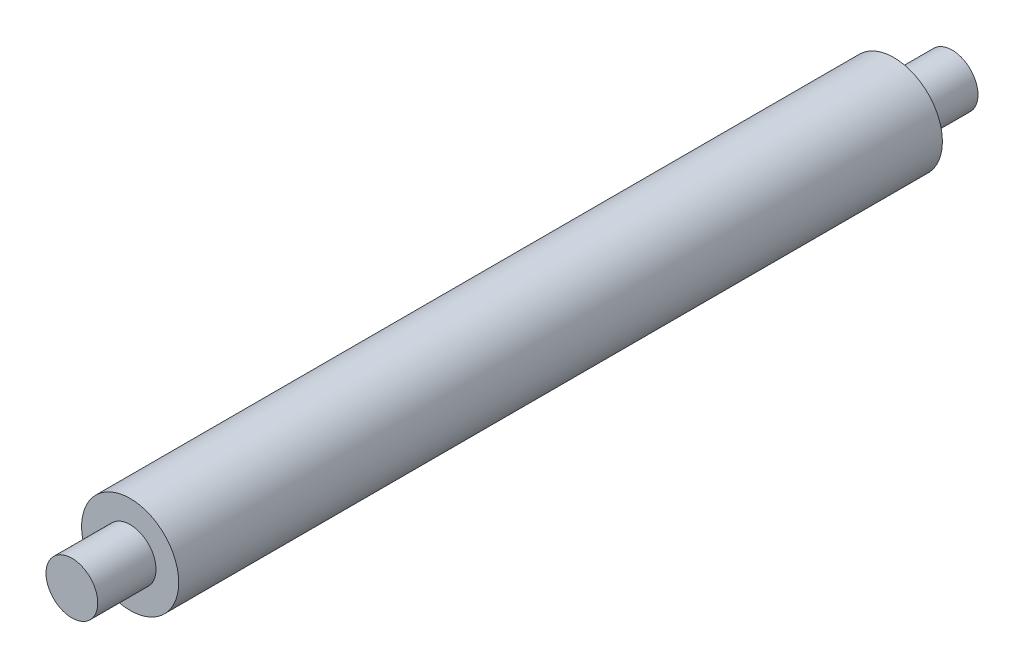
from build123d import *

# Parameters (mm, degrees)
SKETCH1_R           = 37.5
BOSS_EXTRUDE1_DEPTH = 295
SKETCH2_R           = 20
BOSS_EXTRUDE2_DEPTH = 45
BOSS_EXTRUDE3_START = 45
SKETCH3_R           = 20
BOSS_EXTRUDE3_DEPTH = 45


with BuildPart() as part:
    # Sketch1 → Boss-Extrude1 (new, symmetric)
    with BuildSketch(Plane.XY):
        Circle(SKETCH1_R)
    extrude(amount=BOSS_EXTRUDE1_DEPTH, both=True)

    # Sketch2 → Boss-Extrude2 (add)
    with BuildSketch(Plane.XY.offset(295)):
        with Locations(Location((0, 0, 0), (0, 0, 180))):
            Circle(SKETCH2_R)
    extrude(amount=BOSS_EXTRUDE2_DEPTH)

    # Sketch3 → Boss-Extrude3 (add)
    with BuildSketch(Plane(origin=(0, 0, -295), x_dir=(-1, 0, 0), z_dir=(0, 0, -1)).offset(BOSS_EXTRUDE3_START)):
        Circle(SKETCH3_R)
    extrude(amount=-BOSS_EXTRUDE3_DEPTH)


solid = part.part
